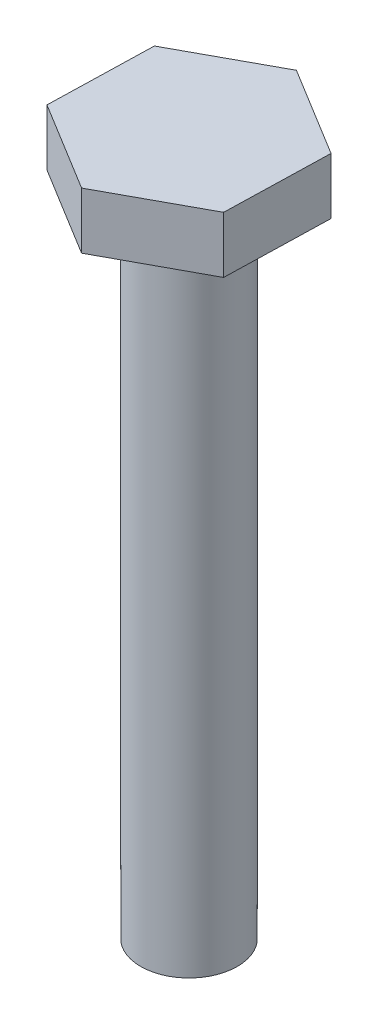
from build123d import *

# Parameters (mm, degrees)
BOSS_EXTRUDE1_DEPTH = 3.5
SKETCH2_R           = 3
BOSS_EXTRUDE2_DEPTH = 40


with BuildPart() as part:
    # Sketch1 → Boss-Extrude1 (new body)
    with BuildSketch(Plane(origin=(0, 0, 0), x_dir=(1, 0, 0), z_dir=(0, 1, 0))):
        Polygon((5.543350936, -3.394298218), (5.711223953, 3.103533624), (0.167873017, 6.497831842), (-5.543350936, 3.394298218), (-5.711223953, -3.103533624), (-0.167873017, -6.497831842), align=None)
    extrude(amount=BOSS_EXTRUDE1_DEPTH)

    # Sketch2 → Boss-Extrude2 (add)
    with BuildSketch(Plane.XZ):
        with Locations(Location((0, 0, 0), (0, 0, 90))):
            Circle(SKETCH2_R)
    extrude(amount=BOSS_EXTRUDE2_DEPTH)


solid = part.part
